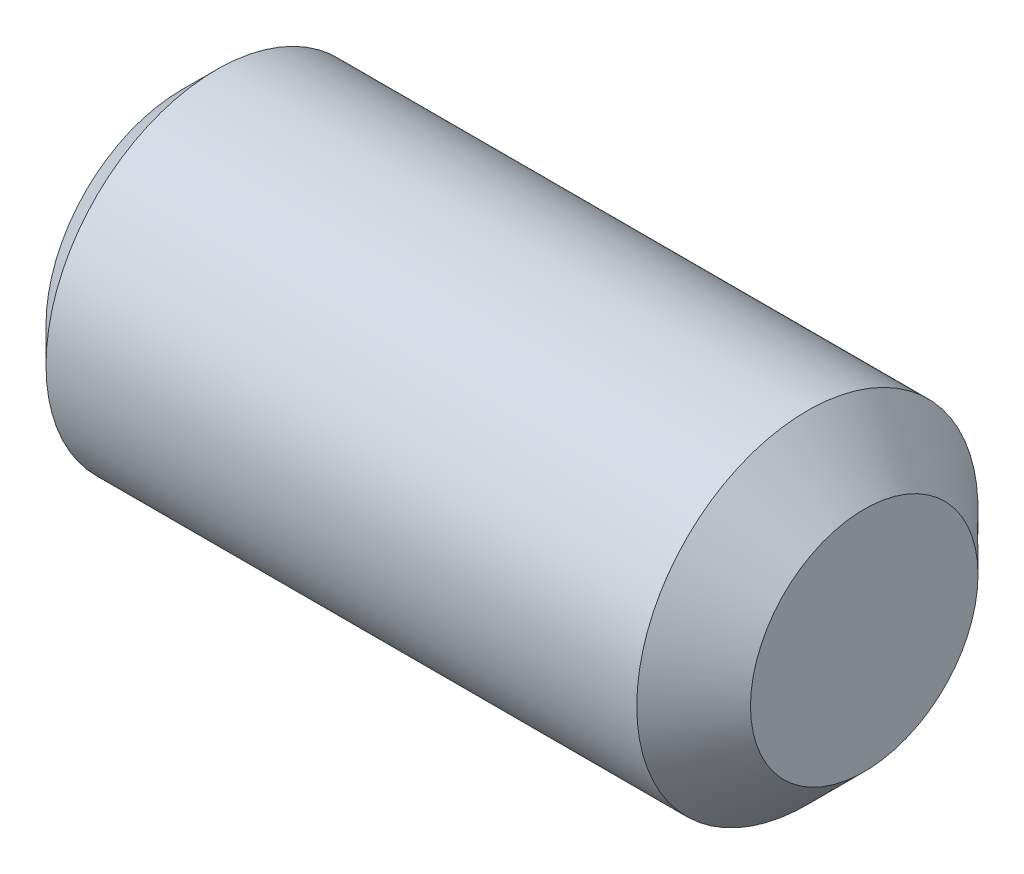
from build123d import *

# Parameters (mm, degrees)
SKETCH3_W          = 2
SKETCH3_H          = 0.75
CUT_EXTRUDE1_DEPTH = 2


with BuildPart() as part:
    # Sketch2 → Revolve1 (revolve)
    with BuildSketch(Plane.XY):
        Polygon((0, 0), (0, 1.1935), (0.3065, 1.5), (5.5, 1.5), (6, 1), (6, 0), align=None)
    revolve(axis=Axis((6, 0, 0), (-1, 0, 0)))

    # Sketch3 → Cut-Revolve1 (revolve, cut)
    with BuildSketch(Plane.XY):
        with Locations((1, 0.375)):
            Rectangle(SKETCH3_W, SKETCH3_H)
    revolve(axis=Axis((2, 0, 0), (-1, 0, 0)), mode=Mode.SUBTRACT)

    # Sketch4 → Cut-Revolve2 (revolve, cut)
    with BuildSketch(Plane.XY):
        Polygon((2, 0), (2, 0.75), (2.433012702, 0), align=None)
    revolve(axis=Axis((2.433012702, 0, 0), (-1, 0, 0)), mode=Mode.SUBTRACT)

    # Sketch5 → Cut-Revolve3 (revolve, cut)
    with BuildSketch(Plane.XY):
        Polygon((-0.3, 0.75), (0.066987298, 0.75), (0, 0.866025404), (-0.3, 0.866025404), align=None)
    revolve(axis=Axis((0, 0, 0), (-1, 0, 0)), mode=Mode.SUBTRACT)

    # Sketch1 → Cut-Extrude1 (cut)
    with BuildSketch(Plane(origin=(0, 0, 0), x_dir=(0, 0, -1), z_dir=(1, 0, 0))):
        Polygon((-0.75, -0.433012702), (0, -0.866025404), (0.75, -0.433012702), (0.75, 0.433012702), (0, 0.866025404), (-0.75, 0.433012702), align=None)
    extrude(amount=CUT_EXTRUDE1_DEPTH, mode=Mode.SUBTRACT)


solid = part.part
